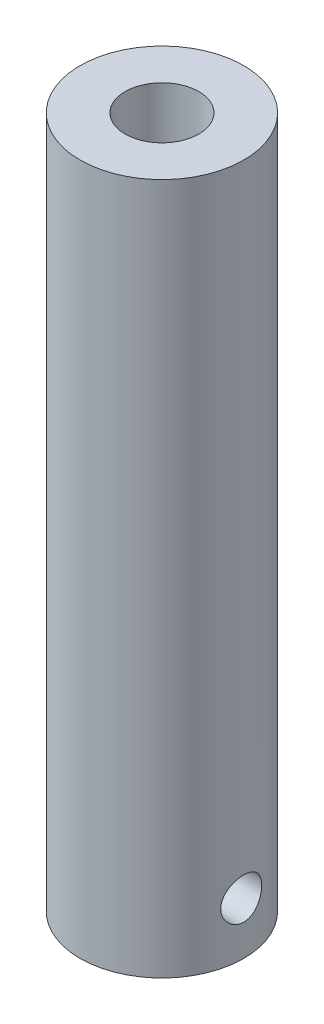
from build123d import *

# Parameters (mm, degrees)
SZKIC1_R                        = 2
DODANIE_WYCI_GNI_CIE1_DEPTH     = 16.9
SZKIC2_R                        = 0.9
WYTNIJ_WYCI_GNI_CIE1_DEPTH      = 10
WYTNIJ_WYCI_GNI_CIE2_DEPTH      = 18.135051794
WYTNIJ_WYCI_GNI_CIE2_DEPTH_BACK = 18.135051794
SZKIC3_R                        = 0.5


with BuildPart() as part:
    # Szkic1 → Dodanie-wyciągnięcie1 (new body)
    with BuildSketch(Plane(origin=(0, 0, 0), x_dir=(1, 0, 0), z_dir=(0, 1, 0))):
        with Locations(Location((0, 0, 0), (0, 0, 270))):
            Circle(SZKIC1_R)
    extrude(amount=DODANIE_WYCI_GNI_CIE1_DEPTH)

    # Szkic2 → Wytnij-wyciągnięcie1 (cut)
    with BuildSketch(Plane(origin=(0, 16.9, 0), x_dir=(1, 0, 0), z_dir=(0, 1, 0))):
        with Locations(Location((0, 0, 0), (0, 0, 270))):
            Circle(SZKIC2_R)
    extrude(amount=-WYTNIJ_WYCI_GNI_CIE1_DEPTH, mode=Mode.SUBTRACT)

    # Szkic3 → Wytnij-wyciągnięcie2 (cut, two sides: drawn at the far end of the back side and taken through both)
    with BuildSketch(Plane(origin=(0, 0, 0), x_dir=(0, 0, -1), z_dir=(1, 0, 0)).offset(-WYTNIJ_WYCI_GNI_CIE2_DEPTH_BACK)):
        with Locations((0, 1.268865349)):
            Circle(SZKIC3_R)
    extrude(amount=WYTNIJ_WYCI_GNI_CIE2_DEPTH + WYTNIJ_WYCI_GNI_CIE2_DEPTH_BACK, mode=Mode.SUBTRACT)


solid = part.part
